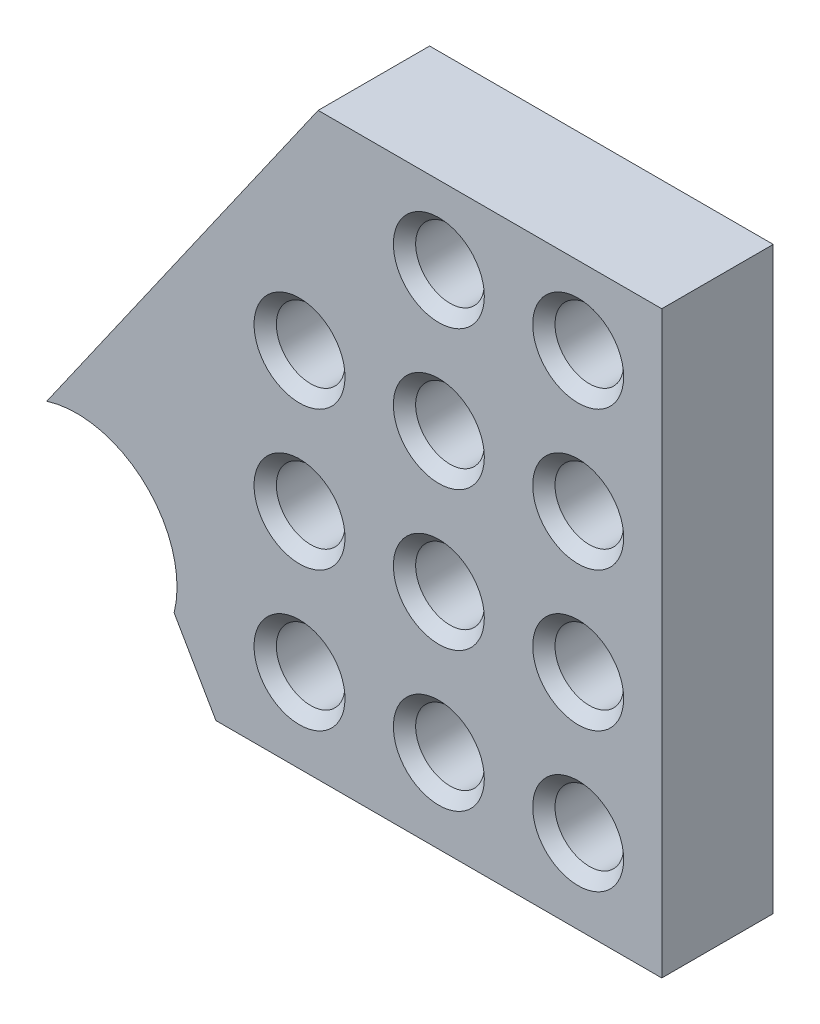
from build123d import *

# Parameters (mm, degrees)
BOSS_EXTRUDE1_DEPTH                   = 6.35
F_23_0_154_DIAMETER_HOLE1_D           = 3.9116
F_23_0_154_DIAMETER_HOLE1_CSINK_D     = 5.1816
F_23_0_154_DIAMETER_HOLE1_CSINK_ANGLE = 90
LPATTERN1_COUNT                       = 4
LPATTERN1_PITCH                       = 7.9375
LPATTERN1_COUNT_DIR2                  = 3
LPATTERN1_PITCH_DIR2                  = 7.9375


with BuildPart() as part:
    # Sketch1 → Boss-Extrude1 (new body)
    with BuildSketch(Plane.XY):
        with BuildLine():
            Line((-25.4, 0), (0, 0))
            Line((0, 0), (0, 33.02))
            Line((0, 33.02), (-19.576328296, 33.02))
            Line((-19.576328296, 33.02), (-33.216892644, 13.539255216))
            Line((-33.216892644, 13.539255216), (-31.734093122, 10.970971108))
            ThreePointArc((-31.734093122, 10.970971108), (-28.382856233, 8.341458547), (-27.78125, 4.124445986))
            Line((-27.78125, 4.124445986), (-25.4, 0))
        make_face()
        with BuildLine():
            Line((-31.734093122, 10.970971108), (-33.216892644, 13.539255216))
            Line((-33.216892644, 13.539255216), (-35.037997829, 10.938447476))
            ThreePointArc((-35.037997829, 10.938447476), (-33.388447139, 11.198681663), (-31.734093122, 10.970971108))
        make_face()
    extrude(amount=BOSS_EXTRUDE1_DEPTH)

    # #23 (0.154) Diameter Hole1 (through all)
    with Locations(Plane(origin=(-4.7625, 4.7625, 6.35), x_dir=(1, 0, 0), z_dir=(0, 0, 1))):
        with Locations((0, 0)):
            f_23_0_154_diameter_hole1 = CounterSinkHole(F_23_0_154_DIAMETER_HOLE1_D / 2, F_23_0_154_DIAMETER_HOLE1_CSINK_D / 2, counter_sink_angle=F_23_0_154_DIAMETER_HOLE1_CSINK_ANGLE)

    # LPattern1: 23 _0.154_ Diameter Hole1 4 × 3, 1 skipped
    with Locations(*[(-j * LPATTERN1_PITCH_DIR2, i * LPATTERN1_PITCH, 0) for i in range(LPATTERN1_COUNT) for j in range(LPATTERN1_COUNT_DIR2) if (i, j) not in ((0, 0), (3, 2))]):
        add(f_23_0_154_diameter_hole1, mode=Mode.SUBTRACT)


solid = part.part
